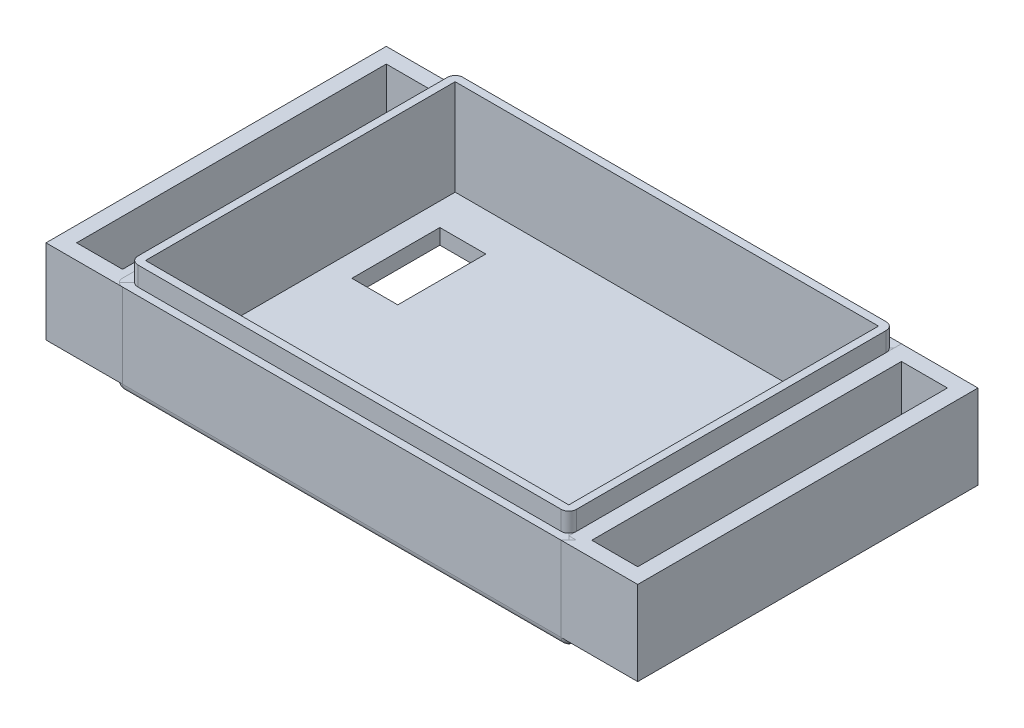
from build123d import *

# Parameters (mm, degrees)
SKETCH1_W              = 59.31
SKETCH1_H              = 44.46
BOSS_EXTRUDE1_DEPTH    = 2
SKETCH2_W              = 59.31
SKETCH2_H              = 44.46
SKETCH2_W_2            = 55.31
SKETCH2_H_2            = 40.46
BOSS_EXTRUDE2_DEPTH    = 12.5
SKETCH3_W              = 1
SKETCH3_H              = 2.5
FILLET1_R              = 1
SKETCH5_W              = 6
SKETCH5_H              = 11.5
CUT_EXTRUDE1_DEPTH     = 10
BOSS_EXTRUDE3_DEPTH    = 2
BOSS_EXTRUDE10_START   = -1
SKETCH7_W              = 6
SKETCH7_H              = 40.46
BOSS_EXTRUDE10_DEPTH   = 11
SKETCH7_W_2            = 6.003374691
BOSS_EXTRUDE10_2_DEPTH = 11


with BuildPart() as part:
    # Sketch1 → Boss-Extrude1 (new body)
    with BuildSketch(Plane(origin=(0, 0, 0), x_dir=(1, 0, 0), z_dir=(0, 1, 0))):
        Rectangle(SKETCH1_W, SKETCH1_H)
    extrude(amount=BOSS_EXTRUDE1_DEPTH)

    # Sketch2 → Boss-Extrude2 (add)
    with BuildSketch(Plane(origin=(0, 2, 0), x_dir=(1, 0, 0), z_dir=(0, 1, 0))):
        Rectangle(SKETCH2_W, SKETCH2_H)
        Rectangle(SKETCH2_W_2, SKETCH2_H_2, mode=Mode.SUBTRACT)
    extrude(amount=BOSS_EXTRUDE2_DEPTH)

    # Cut-Sweep1: sweep along a path in Sketch4
    with BuildLine(Plane(origin=(0, 14.5, 0), x_dir=(1, 0, 0), z_dir=(0, 1, 0))) as cut_sweep1_path:
        Line((-29.655, -22.23), (29.655, -22.23))
        Line((29.655, -22.23), (29.655, 22.23))
        Line((29.655, 22.23), (-29.655, 22.23))
        Line((-29.655, 22.23), (-29.655, -22.23))
    # Sketch3 → Cut-Sweep1 (sweep, cut)
    with BuildSketch(Plane(origin=(29.655, 0, 0), x_dir=(0, 0, -1), z_dir=(1, 0, 0))):
        with Locations((-21.73, 13.25)):
            Rectangle(SKETCH3_W, SKETCH3_H)
    sweep(path=cut_sweep1_path.line, transition=Transition.RIGHT, mode=Mode.SUBTRACT)

    # Fillet1
    fillet1_edges = [part.edges().sort_by_distance(p)[0] for p in [
        (29.655, 6, 22.23),
        (-29.655, 6, 22.23),
        (-29.655, 6, -22.23),
        (29.655, 6, -22.23),
        (-28.655, 13.25, -21.23),
        (28.655, 13.25, -21.23),
        (28.655, 13.25, 21.23),
        (-28.655, 13.25, 21.23),
        (29.655, 0, 0),
        (0, 0, -22.23),
        (-29.655, 0, 0),
        (0, 0, 22.23),
    ]]
    fillet(fillet1_edges, radius=FILLET1_R)

    # Sketch5 → Cut-Extrude1 (cut)
    with BuildSketch(Plane(origin=(0, 0, 0), x_dir=(-1, 0, 0), z_dir=(0, -1, 0))):
        with Locations((21.655, 9.48)):
            Rectangle(SKETCH5_W, SKETCH5_H)
    extrude(amount=-CUT_EXTRUDE1_DEPTH, mode=Mode.SUBTRACT)

    # Sketch6 → Boss-Extrude3 (add)
    with BuildSketch(Plane.XZ):
        with BuildLine():
            Line((3.668359532, 11.043003806), (5.069466615, 11.043003806))
            Line((5.069466615, 11.043003806), (13.724692633, -5.981200546))
            add(Edge.make_bspline(
                [(13.724692633, -5.981200546), (13.770465415, -6.066255609), (13.860276332, -6.233142412), (14.049596398, -6.44471403), (14.259282132, -6.635498751), (14.514562764, -6.779774023), (14.797989941, -6.899882103), (15.118123905, -6.972877212), (15.467702486, -7.031048399), (15.713066528, -7.034166281), (15.841418927, -7.035797276)],
                knots=[0, 0, 0, 0, 0.923122777, 1.811262043, 2.707284477, 3.630407254, 4.607627564, 5.650245945, 6.770820012, 8, 8, 8, 8], degree=3))
            Line((15.841418927, -7.035797276), (16.587169471, -7.035797276))
            Line((16.587169471, -7.035797276), (16.587169471, -8))
            Line((16.587169471, -8), (6.704091546, -8))
            Line((6.704091546, -8), (6.704091546, -7.035797276))
            Line((6.704091546, -7.035797276), (7.491272677, -7.035797276))
            add(Edge.make_bspline(
                [(7.491272677, -7.035797276), (7.615561715, -7.034972065), (7.854152468, -7.033387954), (8.197254943, -7.024270941), (8.510837169, -6.998643255), (8.797935797, -6.976226749), (9.056099226, -6.935998597), (9.287242582, -6.897915489), (9.488634661, -6.845109649), (9.610791127, -6.800614432), (9.66826164, -6.779680927)],
                knots=[0, 0, 0, 0, 1.354335262, 2.59984206, 3.738199698, 4.78223889, 5.735982514, 6.583888141, 7.33376694, 8, 8, 8, 8], degree=3))
            add(Edge.make_bspline(
                [(9.66826164, -6.779680927), (9.734616654, -6.749406693), (9.857910933, -6.693154125), (9.99935023, -6.559441952), (10.092017823, -6.401790611), (10.10075551, -6.2849798), (10.105166, -6.226017644)],
                knots=[0, 0, 0, 0, 1.157571245, 2.15088362, 3.06662844, 4, 4, 4, 4], degree=3))
            add(Edge.make_bspline(
                [(10.105166, -6.226017644), (10.098921578, -6.149754311), (10.08575846, -5.988992716), (10.021947105, -5.840695302), (9.988407076, -5.762748366)],
                knots=[0, 0, 0, 0, 0.948775522, 2, 2, 2, 2], degree=3))
            Line((9.988407076, -5.762748366), (7.939476287, -1.732682292))
            Line((7.939476287, -1.732682292), (-1.495398027, -1.732682292))
            Line((-1.495398027, -1.732682292), (-2.666753681, -4.045262263))
            add(Edge.make_bspline(
                [(-2.666753681, -4.045262263), (-2.73463111, -4.18986222), (-2.860946743, -4.458953658), (-2.99975414, -4.849828516), (-3.097335174, -5.191789881), (-3.109447861, -5.40819885), (-3.114957291, -5.506632017)],
                knots=[0, 0, 0, 0, 1.244034282, 2.315069679, 3.233612959, 4, 4, 4, 4], degree=3))
            add(Edge.make_bspline(
                [(-3.114957291, -5.506632017), (-3.105178856, -5.610008506), (-3.085538794, -5.817640973), (-2.930679332, -6.11109022), (-2.683549261, -6.372065908), (-2.348052402, -6.608977598), (-1.921244388, -6.804306269), (-1.406472367, -6.937233956), (-0.80918362, -7.025851211), (-0.382171294, -7.032338986), (-0.154553614, -7.035797276)],
                knots=[0, 0, 0, 0, 0.676796425, 1.359350793, 2.130179084, 3.02304161, 4.041766613, 5.196580708, 6.505645488, 8, 8, 8, 8], degree=3))
            Line((-0.154553614, -7.035797276), (0.677824519, -7.035797276))
            Line((0.677824519, -7.035797276), (0.677824519, -8))
            Line((0.677824519, -8), (-8.241050681, -8))
            Line((-8.241050681, -8), (-8.241050681, -7.035797276))
            add(Edge.make_bspline(
                [(-8.241050681, -7.035797276), (-8.00595871, -7.030682959), (-7.560198321, -7.020985648), (-6.930404722, -6.931476506), (-6.376944833, -6.783238723), (-5.886269273, -6.568068877), (-5.442332689, -6.26093688), (-5.039212162, -5.844454164), (-4.645254972, -5.330344026), (-4.423041234, -4.933672593), (-4.305145029, -4.723217304)],
                knots=[0, 0, 0, 0, 1.157126977, 2.194040787, 3.123941644, 3.970721164, 4.81957436, 5.763811563, 6.813583119, 8, 8, 8, 8], degree=3))
            Line((-4.305145029, -4.723217304), (3.668359532, 11.043003806))
        make_face()
        Polygon((3.208856671, 7.570367432), (-1.009530248, -0.768479567), (7.446075674, -0.768479567), align=None, mode=Mode.SUBTRACT)
    extrude(amount=BOSS_EXTRUDE3_DEPTH)


with BuildPart() as body_2:
    # Sketch7 → Boss-Extrude10 (new body)
    with BuildSketch(Plane.XZ.offset(BOSS_EXTRUDE10_START)):
        Polygon((-28.655, 20.23), (-28.655, -20.23), (-28.655, -22.23), (-38.655, -22.23), (-38.655, 22.23), (-28.655, 22.23), align=None)
        with Locations((-33.655, 0)):
            Rectangle(SKETCH7_W, SKETCH7_H, mode=Mode.SUBTRACT)
    extrude(amount=-BOSS_EXTRUDE10_DEPTH)


with BuildPart() as body_3:
    # Sketch7 → Boss-Extrude10 2 (new body)
    with BuildSketch(Plane.XZ.offset(BOSS_EXTRUDE10_START)):
        Polygon((28.655, -20.23), (28.655, 20.23), (28.655, 22.23), (38.658374691, 22.23), (38.658374691, -22.23), (28.655, -22.23), align=None)
        with Locations((33.656687346, 0)):
            Rectangle(SKETCH7_W_2, SKETCH7_H, mode=Mode.SUBTRACT)
    extrude(amount=-BOSS_EXTRUDE10_2_DEPTH)


solid = Compound([part.part, body_2.part, body_3.part])
